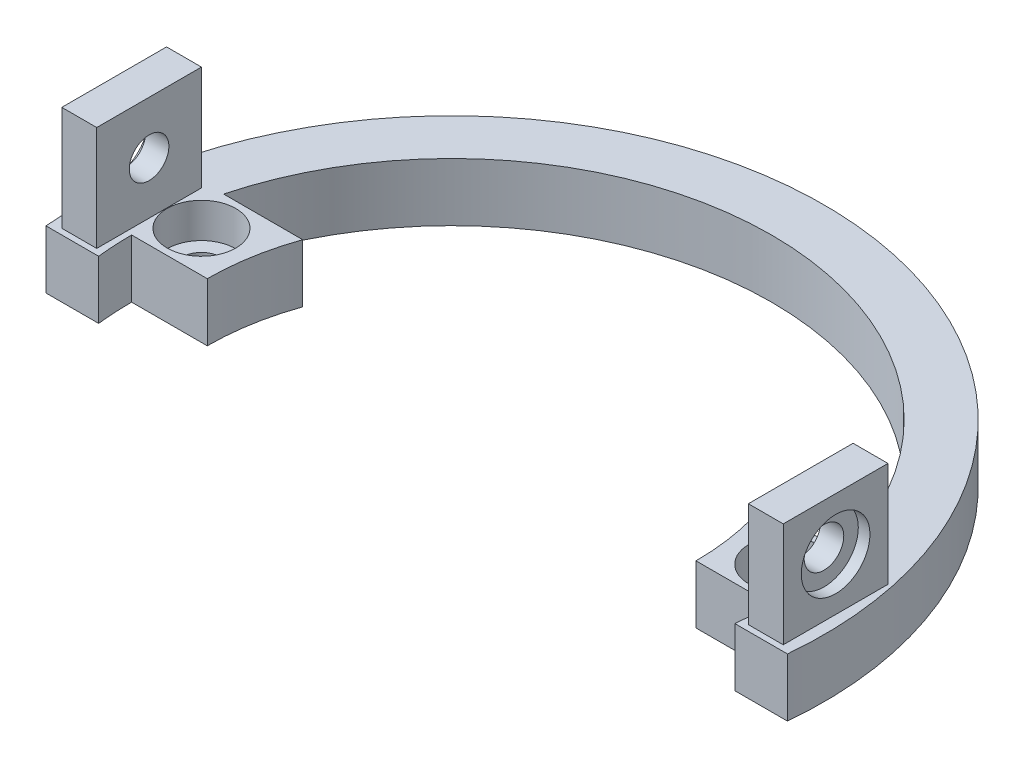
from build123d import *

# Parameters (mm, degrees)
CROQUIS1_R              = 1.7
SALIENTE_EXTRUIR1_DEPTH = 5
CROQUIS3_R              = 2.95
CORTAR_EXTRUIR1_DEPTH   = 3
SKETCH1_W               = 3
SKETCH1_H               = 9
BOSS_EXTRUDE1_DEPTH     = 9
CUT_EXTRUDE3_DEPTH      = 10
CUT_EXTRUDE3_DEPTH_BACK = 73
SKETCH2_R               = 1.7
SKETCH4_R               = 2.95
CUT_EXTRUDE4_DEPTH      = 1
CUT_EXTRUDE5_START      = -1
SKETCH5_R               = 2.95
CUT_EXTRUDE5_DEPTH      = 1


with BuildPart() as part:
    # Croquis1 → Saliente-Extruir1 (new body)
    with BuildSketch(Plane(origin=(0, 0, 0), x_dir=(1, 0, 0), z_dir=(0, 1, 0))):
        with BuildLine():
            Line((-31.859064644, -3), (-27.335873866, -3))
            ThreePointArc((-27.335873866, -3), (-27.45893781, -1.502243105), (-27.5, 0))
            Line((-27.5, 0), (-21, 0))
            ThreePointArc((-21, 0), (-20.697569753, 3.551141553), (-19.798989873, 7))
            Line((-19.798989873, 7), (-26.594172294, 7))
            ThreePointArc((-26.594172294, 7), (0, 27.5), (26.594172294, 7))
            Line((26.594172294, 7), (19.798989873, 7))
            ThreePointArc((19.798989873, 7), (20.697569753, 3.551141553), (21, 0))
            Line((21, 0), (27.5, 0))
            ThreePointArc((27.5, 0), (27.45893781, -1.502243105), (27.335873866, -3))
            Line((27.335873866, -3), (31.859064644, -3))
            ThreePointArc((31.859064644, -3), (0, 32), (-31.859064644, -3))
        make_face()
        with Locations(Location((-25, 3.5, 0), (0, 0, 270))):
            Circle(CROQUIS1_R, mode=Mode.SUBTRACT)
        with Locations(Location((25, 3.5, 0), (0, 0, 270))):
            Circle(CROQUIS1_R, mode=Mode.SUBTRACT)
    extrude(amount=SALIENTE_EXTRUIR1_DEPTH)

    # Croquis3 → Cortar-Extruir1 (cut)
    with BuildSketch(Plane(origin=(0, 5, 0), x_dir=(1, 0, 0), z_dir=(0, 1, 0))):
        with Locations(Location((-25, 3.5, 0), (0, 0, 270))):
            Circle(CROQUIS3_R)
        with Locations(Location((25, 3.5, 0), (0, 0, 270))):
            Circle(CROQUIS3_R)
    extrude(amount=-CORTAR_EXTRUIR1_DEPTH, mode=Mode.SUBTRACT)

    # Sketch1 → Boss-Extrude1 (add)
    with BuildSketch(Plane(origin=(0, 5, 0), x_dir=(1, 0, 0), z_dir=(0, 1, 0))):
        with Locations((-29.5, 2)):
            Rectangle(SKETCH1_W, SKETCH1_H)
        with Locations((29.5, 2)):
            Rectangle(SKETCH1_W, SKETCH1_H)
    extrude(amount=BOSS_EXTRUDE1_DEPTH)

    # Sketch2 → Cut-Extrude3 (cut, two sides: drawn at the far end of the back side and taken through both)
    with BuildSketch(Plane.ZY.offset(31).offset(-CUT_EXTRUDE3_DEPTH_BACK)):
        with Locations(Location((-2, 9.5, 0), (0, 0, 180))):
            Circle(SKETCH2_R)
    extrude(amount=CUT_EXTRUDE3_DEPTH + CUT_EXTRUDE3_DEPTH_BACK, mode=Mode.SUBTRACT)

    # Sketch4 → Cut-Extrude4 (cut)
    with BuildSketch(Plane.ZY.offset(31)):
        with Locations((-2, 9.5)):
            Circle(SKETCH4_R)
    extrude(amount=-CUT_EXTRUDE4_DEPTH, mode=Mode.SUBTRACT)

    # Sketch5 → Cut-Extrude5 (cut)
    with BuildSketch(Plane(origin=(31, 0, 0), x_dir=(0, 0, -1), z_dir=(1, 0, 0)).offset(CUT_EXTRUDE5_START)):
        with Locations(Location((2, 9.5, 0), (0, 0, 180))):
            Circle(SKETCH5_R)
    extrude(amount=CUT_EXTRUDE5_DEPTH, mode=Mode.SUBTRACT)


solid = part.part
